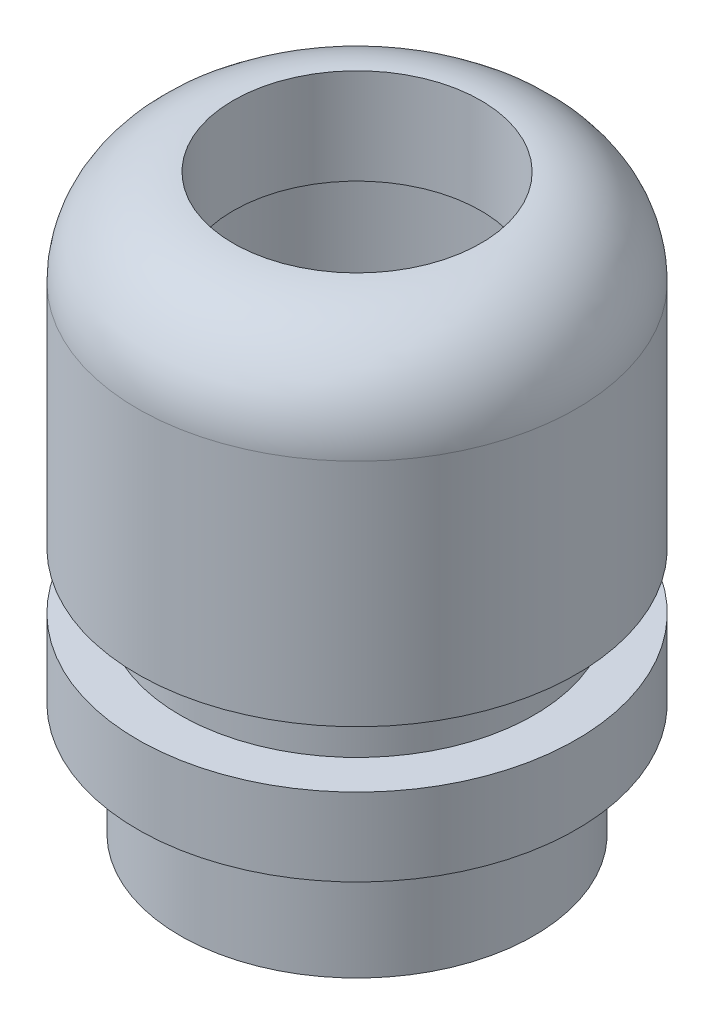
from build123d import *


with BuildPart() as part:
    # Skizze2 → Rotation1 (revolve)
    with BuildSketch(Plane.XY):
        with BuildLine():
            Line((8.75, 20.25), (11.5, 20.25))
            Line((11.5, 20.25), (11.5, -13.5))
            Line((11.5, -13.5), (12.5, -13.5))
            Line((12.5, -13.5), (12.5, -5.5))
            Line((12.5, -5.5), (15.5, -5.5))
            Line((15.5, -5.5), (15.5, 0))
            Line((15.5, 0), (12.5, 0))
            Line((12.5, 0), (12.5, 4))
            Line((12.5, 4), (15.5, 4))
            Line((15.5, 4), (15.5, 20.25))
            ThreePointArc((15.5, 20.25), (13.522970773, 25.022970773), (8.75, 27))
            Line((8.75, 27), (8.75, 20.25))
        make_face()
    revolve(axis=Axis((0, 275.175103998, 0), (0, -1, 0)))


solid = part.part
